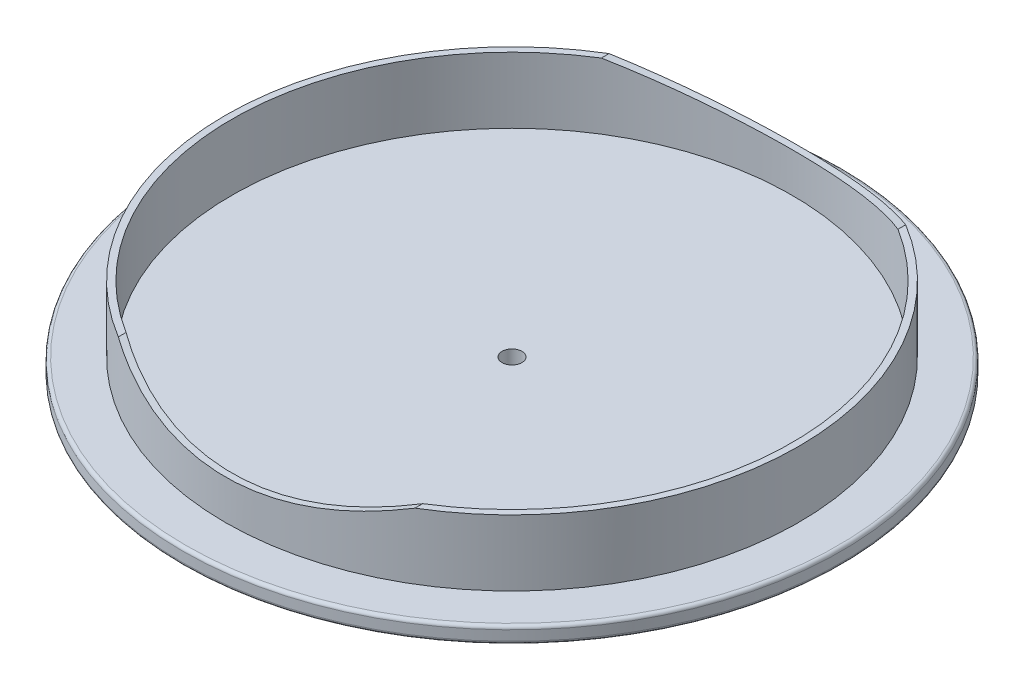
from build123d import *

# Parameters (mm, degrees)
SKETCH2_R               = 100
BOSS_EXTRUDE1_DEPTH     = 5
SKETCH2_3_R             = 87
SKETCH2_3_R_2           = 85
BOSS_EXTRUDE2_DEPTH     = 25
CUT_EXTRUDE1_DEPTH      = 144.614066163
CUT_EXTRUDE1_DEPTH_BACK = 144.614066163
SKETCH4_R               = 3
CUT_EXTRUDE2_DEPTH      = 144.614066181
FILLET1_R               = 1


with BuildPart() as part:
    # Sketch2 → Boss-Extrude1 (new body)
    with BuildSketch(Plane(origin=(0, 0, 0), x_dir=(1, 0, 0), z_dir=(0, 1, 0))):
        Circle(SKETCH2_R)
    extrude(amount=BOSS_EXTRUDE1_DEPTH)

    # Sketch2<3> → Boss-Extrude2 (add)
    with BuildSketch(Plane(origin=(0, 0, 0), x_dir=(1, 0, 0), z_dir=(0, 1, 0))):
        Circle(SKETCH2_3_R)
        Circle(SKETCH2_3_R_2, mode=Mode.SUBTRACT)
    extrude(amount=BOSS_EXTRUDE2_DEPTH)

    # Sketch3 → Cut-Extrude1 (cut, two sides: drawn at the far end of the back side and taken through both)
    with BuildSketch(Plane.XY.offset(-CUT_EXTRUDE1_DEPTH_BACK)):
        with BuildLine():
            Line((-45, 25), (-45, 27.803999392))
            Line((-45, 27.803999392), (45, 27.803999392))
            Line((45, 27.803999392), (45, 25))
            ThreePointArc((45, 25), (0, 16.983491439), (-45, 25))
        make_face()
    extrude(amount=CUT_EXTRUDE1_DEPTH + CUT_EXTRUDE1_DEPTH_BACK, mode=Mode.SUBTRACT)

    # Sketch4 → Cut-Extrude2 (cut, through all)
    with BuildSketch(Plane.XZ):
        Circle(SKETCH4_R)
    extrude(amount=-CUT_EXTRUDE2_DEPTH, mode=Mode.SUBTRACT)

    # Fillet1
    fillet1_edges = [part.edges().sort_by_distance(p)[0] for p in [
        (-100, 0, 0),
        (-100, 5, 0),
    ]]
    fillet(fillet1_edges, radius=FILLET1_R)


solid = part.part
